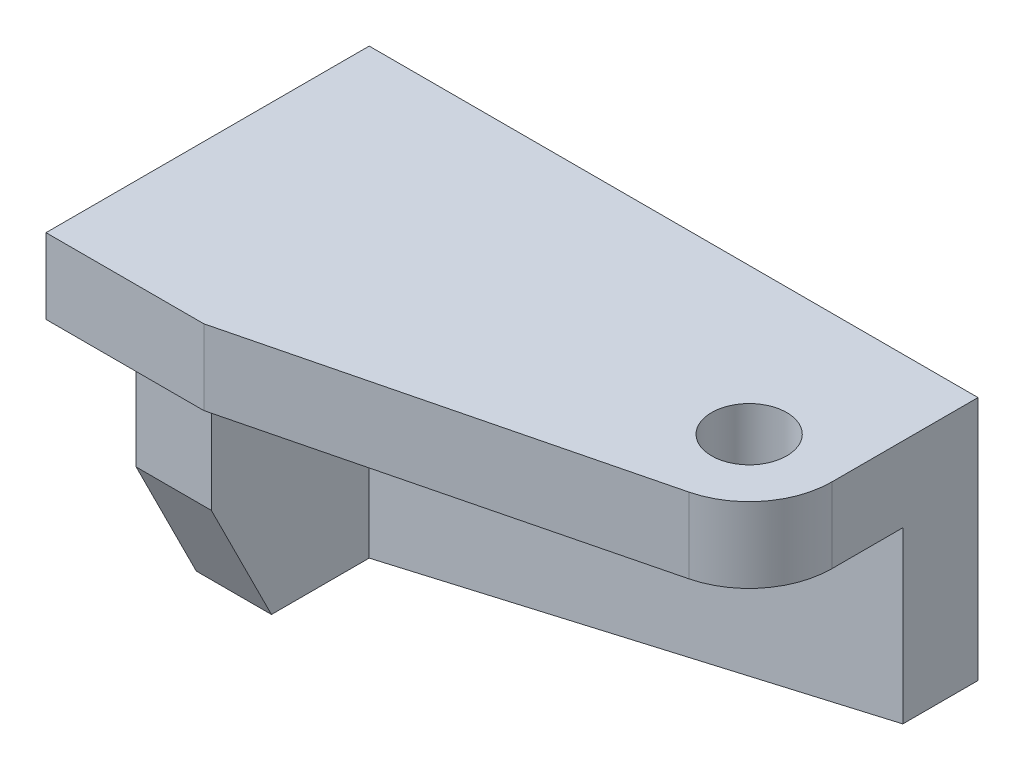
from build123d import *

# Parameters (mm, degrees)
BOSS_EXTRUDE1_DEPTH = 10
BOSS_EXTRUDE2_DEPTH = 10
SKETCH6_R           = 11
SKETCH6_R_2         = 5
BOSS_EXTRUDE3_DEPTH = 10


with BuildPart() as part:
    # Sketch1 → Boss-Extrude1 (new body)
    with BuildSketch(Plane.XY):
        Polygon((0, 0), (71, 0), (71, -22.60835843), (0, -39), align=None)
    extrude(amount=BOSS_EXTRUDE1_DEPTH)

    # Sketch3 → Boss-Extrude2 (add)
    with BuildSketch(Plane.ZY):
        Polygon((0, 0), (31, 0), (31, -23), (23, -39), (0, -39), align=None)
    extrude(amount=BOSS_EXTRUDE2_DEPTH)

    # Sketch6 → Boss-Extrude3 (add)
    # profile 1 of 2: a face of its own
    with BuildSketch(Plane(origin=(0, 0, 0), x_dir=(1, 0, 0), z_dir=(0, 1, 0))):
        with Locations((60, -19.446177938)):
            Circle(SKETCH6_R)
        with Locations(Location((60, -19.446177938, 0), (0, 0, 270))):
            Circle(SKETCH6_R_2, mode=Mode.SUBTRACT)
    # profile 2 of 2: a face of its own
    with BuildSketch(Plane(origin=(0, 0, 0), x_dir=(1, 0, 0), z_dir=(0, 1, 0))):
        with BuildLine():
            Line((71, -19.446177938), (71, 0))
            Line((71, 0), (-10, 0))
            Line((-10, 0), (-10, -43))
            Line((-10, -43), (11, -43))
            Line((11, -43), (62.661140852, -30.119430927))
            ThreePointArc((62.661140852, -30.119430927), (51.33188171, -12.673901709), (71, -19.446177938))
        make_face()
    extrude(amount=BOSS_EXTRUDE3_DEPTH)


solid = part.part
